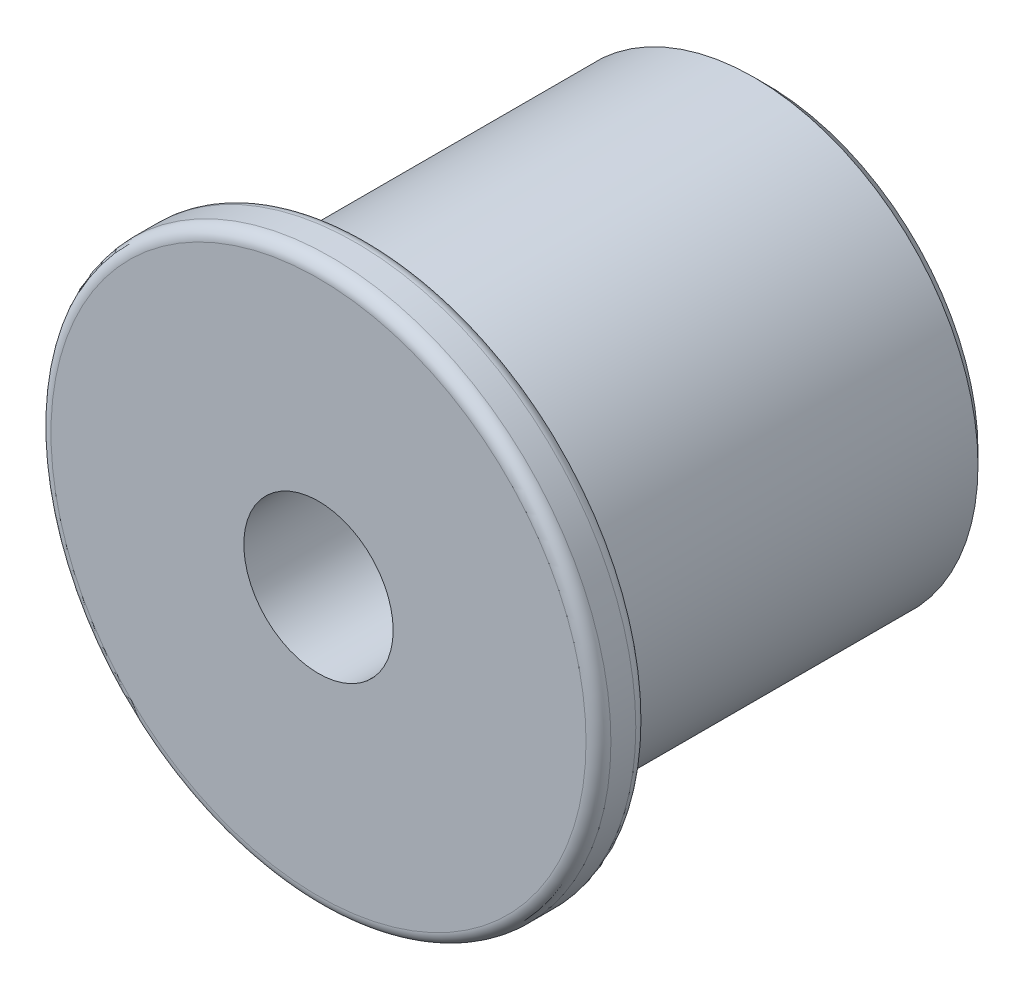
from build123d import *

# Parameters (mm, degrees)
SKETCH1_R           = 9
SKETCH1_R_2         = 3
BOSS_EXTRUDE1_DEPTH = 16
BOSS_EXTRUDE2_START = 2
SKETCH2_R           = 11.25
SKETCH2_R_2         = 3
BOSS_EXTRUDE2_DEPTH = 2
FILLET1_R           = 0.5
FILLET2_R           = 0.5
FILLET3_R           = 0.8
CHAMFER1_SIZE       = 0.5


with BuildPart() as part:
    # Sketch1 → Boss-Extrude1 (new body)
    with BuildSketch(Plane.XY):
        Circle(SKETCH1_R)
        Circle(SKETCH1_R_2, mode=Mode.SUBTRACT)
    extrude(amount=-BOSS_EXTRUDE1_DEPTH)

    # Sketch2 → Boss-Extrude2 (add)
    with BuildSketch(Plane.XY.offset(BOSS_EXTRUDE2_START)):
        Circle(SKETCH2_R)
        Circle(SKETCH2_R_2, mode=Mode.SUBTRACT)
    extrude(amount=-BOSS_EXTRUDE2_DEPTH)

    # Fillet1
    fillet1_edges = [part.edges().sort_by_distance(p)[0] for p in [
        (-11.25, 0, 2),
    ]]
    fillet(fillet1_edges, radius=FILLET1_R)

    # Fillet2
    fillet2_edges = [part.edges().sort_by_distance(p)[0] for p in [
        (-11.25, 0, 0),
    ]]
    fillet(fillet2_edges, radius=FILLET2_R)

    # Fillet3
    fillet3_edges = [part.edges().sort_by_distance(p)[0] for p in [
        (-9, 0, 0),
    ]]
    fillet(fillet3_edges, radius=FILLET3_R)

    # Chamfer1
    chamfer1_edges = [part.edges().sort_by_distance(p)[0] for p in [
        (-9, 0, -16),
    ]]
    chamfer(chamfer1_edges, length=CHAMFER1_SIZE)


solid = part.part
